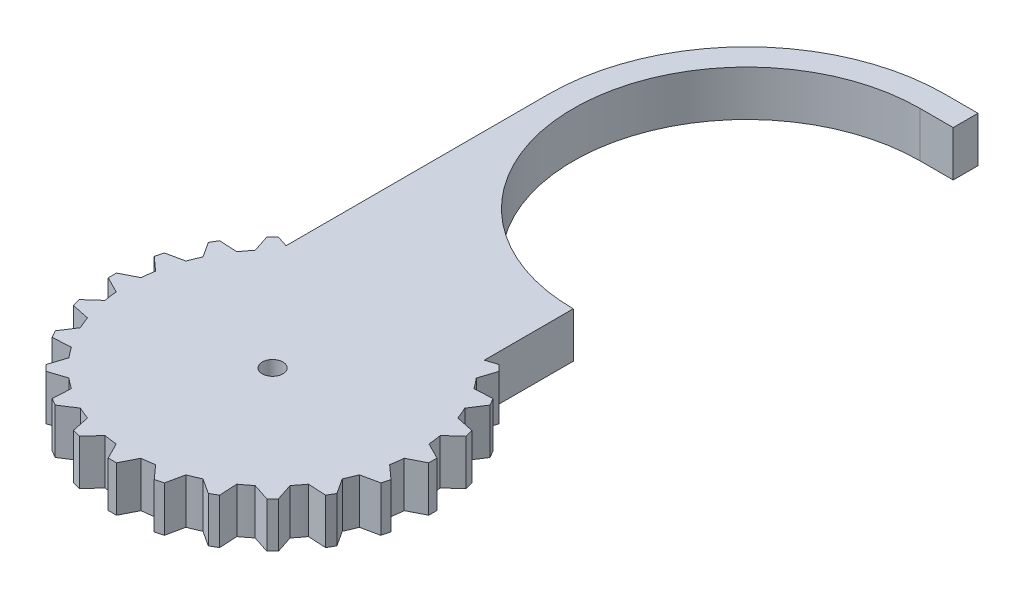
from build123d import *

# Parameters (mm, degrees)
BOSS_EXTRUDE1_DEPTH = 3
SKETCH3_W           = 3
SKETCH3_H           = 3
BOSS_EXTRUDE2_DEPTH = 4
BOSS_EXTRUDE3_START = 2.5
BOSS_EXTRUDE3_DEPTH = 2.5
SKETCH5_R           = 1.25
CUT_EXTRUDE1_DEPTH  = 16.5


with BuildPart() as part:
    # Sketch1 → Boss-Extrude1 (new body)
    with BuildSketch(Plane(origin=(0, 0, 0), x_dir=(1, 0, 0), z_dir=(0, 1, 0))):
        with BuildLine():
            Line((0, 21), (0, 24))
            ThreePointArc((0, 24), (-16.970562748, 16.970562748), (-24, 0))
            Line((-24, 0), (-24, -31.772426197))
            Line((-24, -31.772426197), (-25.364318164, -31.328575054))
            Line((-25.364318164, -31.328575054), (-26.071424946, -32.035681836))
            Line((-26.071424946, -32.035681836), (-25.389488178, -34.131832166))
            ThreePointArc((-25.389488178, -34.131832166), (-25.883683455, -34.746674992), (-26.349668871, -35.383164007))
            Line((-26.349668871, -35.383164007), (-28.550892833, -35.266987298))
            Line((-28.550892833, -35.266987298), (-29.050892833, -36.133012702))
            Line((-29.050892833, -36.133012702), (-27.849668871, -37.981240219))
            ThreePointArc((-27.849668871, -37.981240219), (-28.167891819, -38.703039934), (-28.453263687, -39.438447012))
            Line((-28.453263687, -39.438447012), (-30.609551507, -39.895947612))
            Line((-30.609551507, -39.895947612), (-30.868370553, -40.861873438))
            Line((-30.868370553, -40.861873438), (-29.229720823, -42.33622449))
            ThreePointArc((-29.229720823, -42.33622449), (-29.350285074, -43.115791636), (-29.435595774, -43.9))
            Line((-29.435595774, -43.9), (-31.4, -44.9))
            Line((-31.4, -44.9), (-31.4, -45.9))
            Line((-31.4, -45.9), (-29.435595774, -46.9))
            ThreePointArc((-29.435595774, -46.9), (-29.350285074, -47.684208364), (-29.229720823, -48.46377551))
            Line((-29.229720823, -48.46377551), (-30.868370553, -49.938126562))
            Line((-30.868370553, -49.938126562), (-30.609551507, -50.904052388))
            Line((-30.609551507, -50.904052388), (-28.453263687, -51.361552988))
            ThreePointArc((-28.453263687, -51.361552988), (-28.167891819, -52.096960066), (-27.849668871, -52.818759781))
            Line((-27.849668871, -52.818759781), (-29.050892833, -54.666987298))
            Line((-29.050892833, -54.666987298), (-28.550892833, -55.533012702))
            Line((-28.550892833, -55.533012702), (-26.349668871, -55.416835993))
            ThreePointArc((-26.349668871, -55.416835993), (-25.883683455, -56.053325008), (-25.389488178, -56.668167834))
            Line((-25.389488178, -56.668167834), (-26.071424946, -58.764318164))
            Line((-26.071424946, -58.764318164), (-25.364318164, -59.471424946))
            Line((-25.364318164, -59.471424946), (-23.268167834, -58.789488178))
            ThreePointArc((-23.268167834, -58.789488178), (-22.653325008, -59.283683455), (-22.016835993, -59.749668871))
            Line((-22.016835993, -59.749668871), (-22.133012702, -61.950892833))
            Line((-22.133012702, -61.950892833), (-21.266987298, -62.450892833))
            Line((-21.266987298, -62.450892833), (-19.418759781, -61.249668871))
            ThreePointArc((-19.418759781, -61.249668871), (-18.696960066, -61.567891819), (-17.961552988, -61.853263687))
            Line((-17.961552988, -61.853263687), (-17.504052388, -64.009551507))
            Line((-17.504052388, -64.009551507), (-16.538126562, -64.268370553))
            Line((-16.538126562, -64.268370553), (-15.06377551, -62.629720823))
            ThreePointArc((-15.06377551, -62.629720823), (-14.284208364, -62.750285074), (-13.5, -62.835595774))
            Line((-13.5, -62.835595774), (-12.5, -64.8))
            Line((-12.5, -64.8), (-11.5, -64.8))
            Line((-11.5, -64.8), (-10.5, -62.835595774))
            ThreePointArc((-10.5, -62.835595774), (-9.715791636, -62.750285074), (-8.93622449, -62.629720823))
            Line((-8.93622449, -62.629720823), (-7.461873438, -64.268370553))
            Line((-7.461873438, -64.268370553), (-6.495947612, -64.009551507))
            Line((-6.495947612, -64.009551507), (-6.038447012, -61.853263687))
            ThreePointArc((-6.038447012, -61.853263687), (-5.303039934, -61.567891819), (-4.581240219, -61.249668871))
            Line((-4.581240219, -61.249668871), (-2.733012702, -62.450892833))
            Line((-2.733012702, -62.450892833), (-1.866987298, -61.950892833))
            Line((-1.866987298, -61.950892833), (-1.983164007, -59.749668871))
            ThreePointArc((-1.983164007, -59.749668871), (-1.346674992, -59.283683455), (-0.731832166, -58.789488178))
            Line((-0.731832166, -58.789488178), (1.364318164, -59.471424946))
            Line((1.364318164, -59.471424946), (2.071424946, -58.764318164))
            Line((2.071424946, -58.764318164), (1.389488178, -56.668167834))
            ThreePointArc((1.389488178, -56.668167834), (1.883683455, -56.053325008), (2.349668871, -55.416835993))
            Line((2.349668871, -55.416835993), (4.550892833, -55.533012702))
            Line((4.550892833, -55.533012702), (5.050892833, -54.666987298))
            Line((5.050892833, -54.666987298), (3.849668871, -52.818759781))
            ThreePointArc((3.849668871, -52.818759781), (4.167891819, -52.096960066), (4.453263687, -51.361552988))
            Line((4.453263687, -51.361552988), (6.609551507, -50.904052388))
            Line((6.609551507, -50.904052388), (6.868370553, -49.938126562))
            Line((6.868370553, -49.938126562), (5.229720823, -48.46377551))
            ThreePointArc((5.229720823, -48.46377551), (5.350285074, -47.684208364), (5.435595774, -46.9))
            Line((5.435595774, -46.9), (7.4, -45.9))
            Line((7.4, -45.9), (7.4, -44.9))
            Line((7.4, -44.9), (5.435595774, -43.9))
            ThreePointArc((5.435595774, -43.9), (5.350285074, -43.115791636), (5.229720823, -42.33622449))
            Line((5.229720823, -42.33622449), (6.868370553, -40.861873438))
            Line((6.868370553, -40.861873438), (6.609551507, -39.895947612))
            Line((6.609551507, -39.895947612), (4.453263687, -39.438447012))
            ThreePointArc((4.453263687, -39.438447012), (4.167891819, -38.703039934), (3.849668871, -37.981240219))
            Line((3.849668871, -37.981240219), (5.050892833, -36.133012702))
            Line((5.050892833, -36.133012702), (4.550892833, -35.266987298))
            Line((4.550892833, -35.266987298), (2.349668871, -35.383164007))
            ThreePointArc((2.349668871, -35.383164007), (1.883683455, -34.746674992), (1.389488178, -34.131832166))
            Line((1.389488178, -34.131832166), (2.071424946, -32.035681836))
            Line((2.071424946, -32.035681836), (1.364318164, -31.328575054))
            Line((1.364318164, -31.328575054), (0, -31.772426197))
            Line((0, -31.772426197), (0, -21))
            ThreePointArc((0, -21), (-21, 0), (0, 21))
        make_face()
    extrude(amount=BOSS_EXTRUDE1_DEPTH)

    # Sketch3 → Boss-Extrude2 (add)
    with BuildSketch(Plane(origin=(0, 0, 0), x_dir=(0, 0, -1), z_dir=(1, 0, 0))):
        with Locations((22.5, 1.5)):
            Rectangle(SKETCH3_W, SKETCH3_H)
    extrude(amount=BOSS_EXTRUDE2_DEPTH)

    # Sketch4 → Boss-Extrude3 (add)
    with BuildSketch(Plane.XZ.offset(BOSS_EXTRUDE3_START)):
        with BuildLine():
            Line((0, 31.772426197), (0, 21))
            ThreePointArc((0, 21), (-21, 0), (0, -21))
            Line((0, -21), (4, -21))
            Line((4, -21), (4, -24))
            Line((4, -24), (0, -24))
            ThreePointArc((0, -24), (-16.970562748, -16.970562748), (-24, 0))
            Line((-24, 0), (-24, 31.772426197))
            Line((-24, 31.772426197), (-25.364318164, 31.328575054))
            Line((-25.364318164, 31.328575054), (-26.071424946, 32.035681836))
            Line((-26.071424946, 32.035681836), (-25.389488178, 34.131832166))
            ThreePointArc((-25.389488178, 34.131832166), (-25.883683455, 34.746674992), (-26.349668871, 35.383164007))
            Line((-26.349668871, 35.383164007), (-28.550892833, 35.266987298))
            Line((-28.550892833, 35.266987298), (-29.050892833, 36.133012702))
            Line((-29.050892833, 36.133012702), (-27.849668871, 37.981240219))
            ThreePointArc((-27.849668871, 37.981240219), (-28.167891819, 38.703039934), (-28.453263687, 39.438447012))
            Line((-28.453263687, 39.438447012), (-30.609551507, 39.895947612))
            Line((-30.609551507, 39.895947612), (-30.868370553, 40.861873438))
            Line((-30.868370553, 40.861873438), (-29.229720823, 42.33622449))
            ThreePointArc((-29.229720823, 42.33622449), (-29.350285074, 43.115791636), (-29.435595774, 43.9))
            Line((-29.435595774, 43.9), (-31.4, 44.9))
            Line((-31.4, 44.9), (-31.4, 45.9))
            Line((-31.4, 45.9), (-29.435595774, 46.9))
            ThreePointArc((-29.435595774, 46.9), (-29.350285074, 47.684208364), (-29.229720823, 48.46377551))
            Line((-29.229720823, 48.46377551), (-30.868370553, 49.938126562))
            Line((-30.868370553, 49.938126562), (-30.609551507, 50.904052388))
            Line((-30.609551507, 50.904052388), (-28.453263687, 51.361552988))
            ThreePointArc((-28.453263687, 51.361552988), (-28.167891819, 52.096960066), (-27.849668871, 52.818759781))
            Line((-27.849668871, 52.818759781), (-29.050892833, 54.666987298))
            Line((-29.050892833, 54.666987298), (-28.550892833, 55.533012702))
            Line((-28.550892833, 55.533012702), (-26.349668871, 55.416835993))
            ThreePointArc((-26.349668871, 55.416835993), (-25.883683455, 56.053325008), (-25.389488178, 56.668167834))
            Line((-25.389488178, 56.668167834), (-26.071424946, 58.764318164))
            Line((-26.071424946, 58.764318164), (-25.364318164, 59.471424946))
            Line((-25.364318164, 59.471424946), (-23.268167834, 58.789488178))
            ThreePointArc((-23.268167834, 58.789488178), (-22.653325008, 59.283683455), (-22.016835993, 59.749668871))
            Line((-22.016835993, 59.749668871), (-22.133012702, 61.950892833))
            Line((-22.133012702, 61.950892833), (-21.266987298, 62.450892833))
            Line((-21.266987298, 62.450892833), (-19.418759781, 61.249668871))
            ThreePointArc((-19.418759781, 61.249668871), (-18.696960066, 61.567891819), (-17.961552988, 61.853263687))
            Line((-17.961552988, 61.853263687), (-17.504052388, 64.009551507))
            Line((-17.504052388, 64.009551507), (-16.538126562, 64.268370553))
            Line((-16.538126562, 64.268370553), (-15.06377551, 62.629720823))
            ThreePointArc((-15.06377551, 62.629720823), (-14.284208364, 62.750285074), (-13.5, 62.835595774))
            Line((-13.5, 62.835595774), (-12.5, 64.8))
            Line((-12.5, 64.8), (-11.5, 64.8))
            Line((-11.5, 64.8), (-10.5, 62.835595774))
            ThreePointArc((-10.5, 62.835595774), (-9.715791636, 62.750285074), (-8.93622449, 62.629720823))
            Line((-8.93622449, 62.629720823), (-7.461873438, 64.268370553))
            Line((-7.461873438, 64.268370553), (-6.495947612, 64.009551507))
            Line((-6.495947612, 64.009551507), (-6.038447012, 61.853263687))
            ThreePointArc((-6.038447012, 61.853263687), (-5.303039934, 61.567891819), (-4.581240219, 61.249668871))
            Line((-4.581240219, 61.249668871), (-2.733012702, 62.450892833))
            Line((-2.733012702, 62.450892833), (-1.866987298, 61.950892833))
            Line((-1.866987298, 61.950892833), (-1.983164007, 59.749668871))
            ThreePointArc((-1.983164007, 59.749668871), (-1.346674992, 59.283683455), (-0.731832166, 58.789488178))
            Line((-0.731832166, 58.789488178), (1.364318164, 59.471424946))
            Line((1.364318164, 59.471424946), (2.071424946, 58.764318164))
            Line((2.071424946, 58.764318164), (1.389488178, 56.668167834))
            ThreePointArc((1.389488178, 56.668167834), (1.883683455, 56.053325008), (2.349668871, 55.416835993))
            Line((2.349668871, 55.416835993), (4.550892833, 55.533012702))
            Line((4.550892833, 55.533012702), (5.050892833, 54.666987298))
            Line((5.050892833, 54.666987298), (3.849668871, 52.818759781))
            ThreePointArc((3.849668871, 52.818759781), (4.167891819, 52.096960066), (4.453263687, 51.361552988))
            Line((4.453263687, 51.361552988), (6.609551507, 50.904052388))
            Line((6.609551507, 50.904052388), (6.868370553, 49.938126562))
            Line((6.868370553, 49.938126562), (5.229720823, 48.46377551))
            ThreePointArc((5.229720823, 48.46377551), (5.350285074, 47.684208364), (5.435595774, 46.9))
            Line((5.435595774, 46.9), (7.4, 45.9))
            Line((7.4, 45.9), (7.4, 44.9))
            Line((7.4, 44.9), (5.435595774, 43.9))
            ThreePointArc((5.435595774, 43.9), (5.350285074, 43.115791636), (5.229720823, 42.33622449))
            Line((5.229720823, 42.33622449), (6.868370553, 40.861873438))
            Line((6.868370553, 40.861873438), (6.609551507, 39.895947612))
            Line((6.609551507, 39.895947612), (4.453263687, 39.438447012))
            ThreePointArc((4.453263687, 39.438447012), (4.167891819, 38.703039934), (3.849668871, 37.981240219))
            Line((3.849668871, 37.981240219), (5.050892833, 36.133012702))
            Line((5.050892833, 36.133012702), (4.550892833, 35.266987298))
            Line((4.550892833, 35.266987298), (2.349668871, 35.383164007))
            ThreePointArc((2.349668871, 35.383164007), (1.883683455, 34.746674992), (1.389488178, 34.131832166))
            Line((1.389488178, 34.131832166), (2.071424946, 32.035681836))
            Line((2.071424946, 32.035681836), (1.364318164, 31.328575054))
            Line((1.364318164, 31.328575054), (0, 31.772426197))
        make_face()
        with BuildLine():
            Line((-9.015037689, 25.1), (-7.025062814, 44.9))
            ThreePointArc((-7.025062814, 44.9), (-12, 50.4), (-16.974937186, 44.9))
            Line((-16.974937186, 44.9), (-14.984962311, 25.1))
            ThreePointArc((-14.984962311, 25.1), (-12, 22.4), (-9.015037689, 25.1))
        make_face(mode=Mode.SUBTRACT)
    extrude(amount=-BOSS_EXTRUDE3_DEPTH)

    # Sketch5 → Cut-Extrude1 (cut)
    with BuildSketch(Plane.XZ):
        with Locations(Location((-12, 45.4, 0), (0, 0, 270))):
            Circle(SKETCH5_R)
    extrude(amount=-CUT_EXTRUDE1_DEPTH, mode=Mode.SUBTRACT)


solid = part.part
